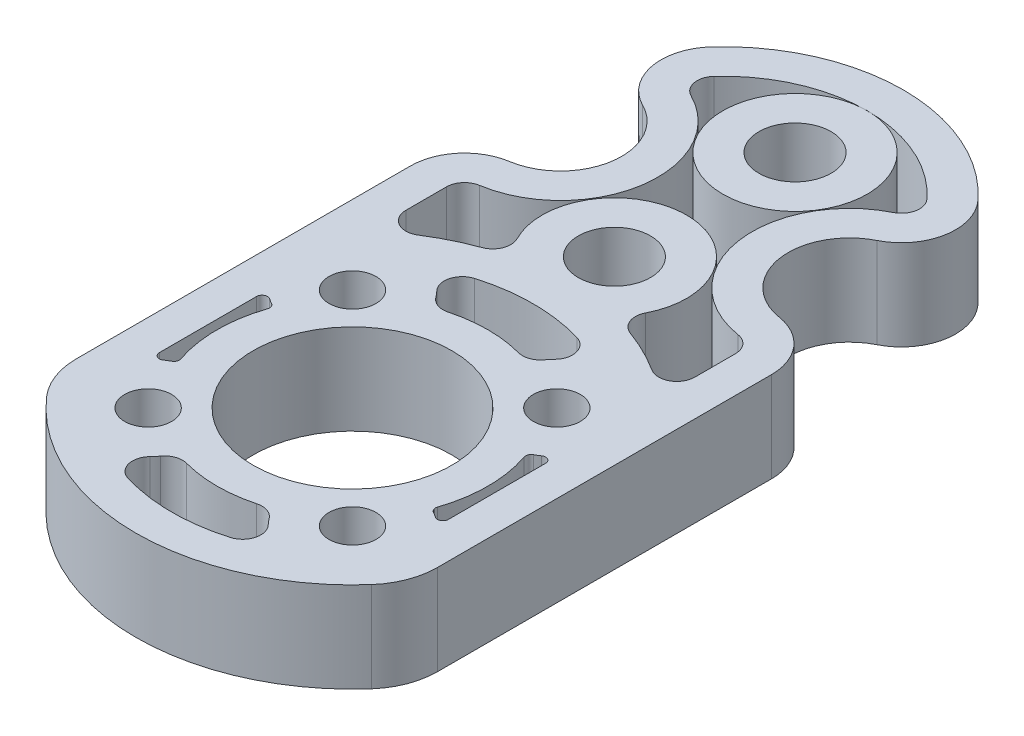
from build123d import *

# Parameters (mm, degrees)
SKETCH1_R             = 4
SKETCH1_R_2           = 2
BOSS_EXTRUDE1_DEPTH   = 5
SKETCH1_R_3           = 5.5
SKETCH1_R_4           = 1.3
BOSS_EXTRUDE1_2_DEPTH = 5


with BuildPart() as part:
    # Sketch1 → Boss-Extrude1 (new body)
    with BuildSketch(Plane(origin=(0, 0, 0), x_dir=(1, 0, 0), z_dir=(0, 1, 0))):
        with Locations(Location((0, 24.5, 0), (0, 0, 270))):
            Circle(SKETCH1_R)
        with Locations(Location((0, 24.5, 0), (0, 0, 270))):
            Circle(SKETCH1_R_2, mode=Mode.SUBTRACT)
    extrude(amount=BOSS_EXTRUDE1_DEPTH)


with BuildPart() as body_2:
    # Sketch1 → Boss-Extrude1 2 (new body)
    with BuildSketch(Plane(origin=(0, 0, 0), x_dir=(1, 0, 0), z_dir=(0, 1, 0))):
        with BuildLine():
            Line((-10, 13.201177736), (-10, -5.291502622))
            ThreePointArc((-10, -5.291502622), (-9.741657387, -6.705716185), (-9, -7.937253933))
            ThreePointArc((-9, -7.937253933), (0, -12), (9, -7.937253933))
            ThreePointArc((9, -7.937253933), (9.741657387, -6.705716185), (10, -5.291502622))
            Line((10, -5.291502622), (10, 13.201177736))
            ThreePointArc((10, 13.201177736), (9.281240934, 15.149494908), (7.469373465, 16.164231659))
            ThreePointArc((7.469373465, 16.164231659), (4.647707204, 18.999766552), (6.489782006, 22.550656446))
            ThreePointArc((6.489782006, 22.550656446), (8.103792448, 24.690809454), (7.362709409, 27.266868564))
            ThreePointArc((7.362709409, 27.266868564), (0, 30.5), (-7.362709409, 27.266868564))
            ThreePointArc((-7.362709409, 27.266868564), (-8.103792448, 24.690809454), (-6.489782006, 22.550656446))
            ThreePointArc((-6.489782006, 22.550656446), (-4.647707204, 18.999766552), (-7.469373465, 16.164231659))
            ThreePointArc((-7.469373465, 16.164231659), (-9.281240934, 15.149494908), (-10, 13.201177736))
        make_face()
        with Locations(Location((0, 0, 0), (0, 0, 270))):
            Circle(SKETCH1_R_3, mode=Mode.SUBTRACT)
        with Locations(Location((0, 14.5, 0), (0, 0, 270))):
            Circle(SKETCH1_R_2, mode=Mode.SUBTRACT)
        with Locations(Location((5.656854249, -5.656854249, 0), (0, 0, 270))):
            Circle(SKETCH1_R_4, mode=Mode.SUBTRACT)
        with Locations(Location((-5.656854249, -5.656854249, 0), (0, 0, 270))):
            Circle(SKETCH1_R_4, mode=Mode.SUBTRACT)
        with Locations(Location((-5.656854249, 5.656854249, 0), (0, 0, 270))):
            Circle(SKETCH1_R_4, mode=Mode.SUBTRACT)
        with Locations(Location((5.656854249, 5.656854249, 0), (0, 0, 270))):
            Circle(SKETCH1_R_4, mode=Mode.SUBTRACT)
        with BuildLine():
            Line((8, 13.201177736), (8, 10.95445115))
            ThreePointArc((8, 10.95445115), (7.480384461, 10.077393131), (6.461538462, 10.111801062))
            ThreePointArc((6.461538462, 10.111801062), (5.315468848, 10.758521782), (4.105476172, 11.275862069))
            ThreePointArc((4.105476172, 11.275862069), (3.516564704, 11.850586026), (3.558079349, 12.672413793))
            ThreePointArc((3.558079349, 12.672413793), (0, 18.5), (-3.558079349, 12.672413793))
            ThreePointArc((-3.558079349, 12.672413793), (-3.516564704, 11.850586026), (-4.105476172, 11.275862069))
            ThreePointArc((-4.105476172, 11.275862069), (-5.315468848, 10.758521782), (-6.461538462, 10.111801062))
            ThreePointArc((-6.461538462, 10.111801062), (-7.480384461, 10.077393131), (-8, 10.95445115))
            Line((-8, 10.95445115), (-8, 13.201177736))
            ThreePointArc((-8, 13.201177736), (-7.760413645, 13.850616793), (-7.156457822, 14.188862377))
            ThreePointArc((-7.156457822, 14.188862377), (-2.670827449, 18.69653985), (-5.599191726, 24.341424145))
            ThreePointArc((-5.599191726, 24.341424145), (-6.137195207, 25.054808481), (-5.890167527, 25.913494851))
            ThreePointArc((-5.890167527, 25.913494851), (0, 28.5), (5.890167527, 25.913494851))
            ThreePointArc((5.890167527, 25.913494851), (6.137195207, 25.054808481), (5.599191726, 24.341424145))
            ThreePointArc((5.599191726, 24.341424145), (2.670827449, 18.69653985), (7.156457822, 14.188862377))
            ThreePointArc((7.156457822, 14.188862377), (7.760413645, 13.850616793), (8, 13.201177736))
        make_face(mode=Mode.SUBTRACT)
        with BuildLine():
            Line((-8, 2.692810484), (-8, -2.692810484))
            ThreePointArc((-8, -2.692810484), (-7.839501534, -2.958402882), (-7.529737854, -2.939814131))
            ThreePointArc((-7.529737854, -2.939814131), (-7.389121197, -2.848073158), (-7.244020458, -2.76360289))
            ThreePointArc((-7.244020458, -2.76360289), (-7.108756707, -2.609441922), (-7.104142592, -2.404403884))
            ThreePointArc((-7.104142592, -2.404403884), (-7.5, 0), (-7.104142592, 2.404403884))
            ThreePointArc((-7.104142592, 2.404403884), (-7.108756707, 2.609441922), (-7.244020458, 2.76360289))
            ThreePointArc((-7.244020458, 2.76360289), (-7.389121197, 2.848073158), (-7.529737854, 2.939814131))
            ThreePointArc((-7.529737854, 2.939814131), (-7.839501534, 2.958402882), (-8, 2.692810484))
        make_face(mode=Mode.SUBTRACT)
        with BuildLine():
            Line((8, 2.692810484), (8, -2.692810484))
            ThreePointArc((8, -2.692810484), (7.839501534, -2.958402882), (7.529737854, -2.939814131))
            ThreePointArc((7.529737854, -2.939814131), (7.389121197, -2.848073158), (7.244020458, -2.76360289))
            ThreePointArc((7.244020458, -2.76360289), (7.108756707, -2.609441922), (7.104142592, -2.404403884))
            ThreePointArc((7.104142592, -2.404403884), (7.5, 0), (7.104142592, 2.404403884))
            ThreePointArc((7.104142592, 2.404403884), (7.108756707, 2.609441922), (7.244020458, 2.76360289))
            ThreePointArc((7.244020458, 2.76360289), (7.389121197, 2.848073158), (7.529737854, 2.939814131))
            ThreePointArc((7.529737854, 2.939814131), (7.839501534, 2.958402882), (8, 2.692810484))
        make_face(mode=Mode.SUBTRACT)
        with BuildLine():
            ThreePointArc((1.939070625, -7.244998628), (2.52792956, -7.267128105), (3.002087997, -7.617011422))
            ThreePointArc((3.002087997, -7.617011422), (3.132604397, -7.782451268), (3.273413635, -7.939223816))
            ThreePointArc((3.273413635, -7.939223816), (3.517593283, -8.887764544), (2.834621004, -9.589834397))
            ThreePointArc((2.834621004, -9.589834397), (0, -10), (-2.834621004, -9.589834397))
            ThreePointArc((-2.834621004, -9.589834397), (-3.517593283, -8.887764544), (-3.273413635, -7.939223816))
            ThreePointArc((-3.273413635, -7.939223816), (-3.132604397, -7.782451268), (-3.002087997, -7.617011422))
            ThreePointArc((-3.002087997, -7.617011422), (-2.52792956, -7.267128105), (-1.939070625, -7.244998628))
            ThreePointArc((-1.939070625, -7.244998628), (0, -7.5), (1.939070625, -7.244998628))
        make_face(mode=Mode.SUBTRACT)
        with BuildLine():
            ThreePointArc((1.939070625, 7.244998628), (0, 7.5), (-1.939070625, 7.244998628))
            ThreePointArc((-1.939070625, 7.244998628), (-2.52792956, 7.267128105), (-3.002087997, 7.617011422))
            ThreePointArc((-3.002087997, 7.617011422), (-3.132604397, 7.782451268), (-3.273413635, 7.939223816))
            ThreePointArc((-3.273413635, 7.939223816), (-3.517593283, 8.887764544), (-2.834621004, 9.589834397))
            ThreePointArc((-2.834621004, 9.589834397), (0, 10), (2.834621004, 9.589834397))
            ThreePointArc((2.834621004, 9.589834397), (3.517593283, 8.887764544), (3.273413635, 7.939223816))
            ThreePointArc((3.273413635, 7.939223816), (3.132604397, 7.782451268), (3.002087997, 7.617011422))
            ThreePointArc((3.002087997, 7.617011422), (2.52792956, 7.267128105), (1.939070625, 7.244998628))
        make_face(mode=Mode.SUBTRACT)
    extrude(amount=BOSS_EXTRUDE1_2_DEPTH)


solid = Compound([part.part, body_2.part])
